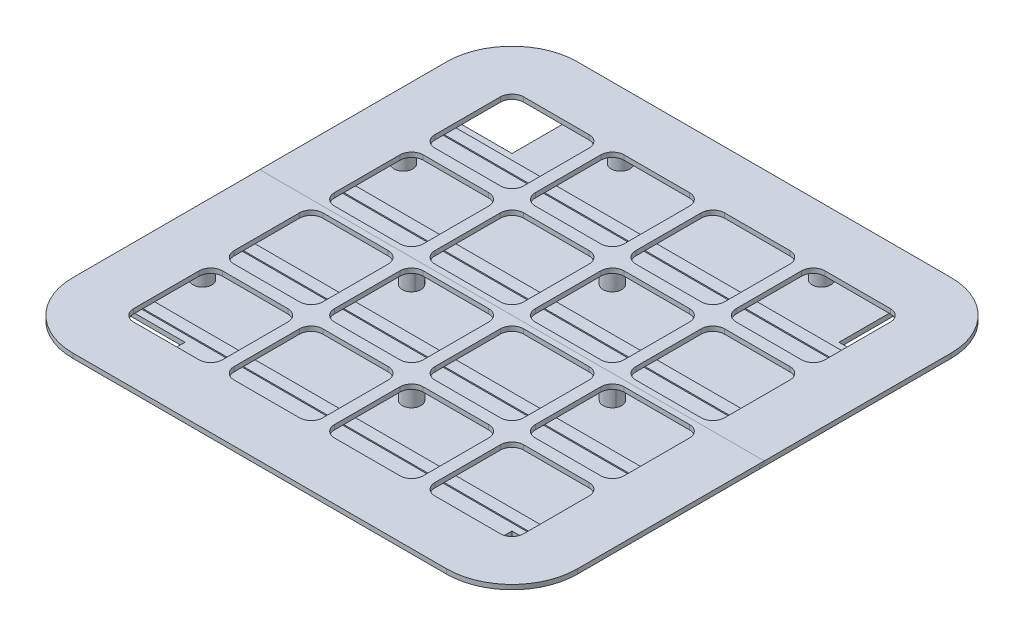
from build123d import *

# Parameters (mm, degrees)
BOSS_EXTRUDE1_DEPTH    = 2
BOSS_EXTRUDE3_START    = 8
BOSS_EXTRUDE3_DEPTH    = 2
SKETCH7_R              = 4
SKETCH7_R_2            = 2.5
BOSS_EXTRUDE7_DEPTH    = 8
SKETCH6_W              = 196
SKETCH6_H              = 5
BOSS_EXTRUDE6_DEPTH    = 0.5
SKETCH7_6_R            = 2.5
CUT_EXTRUDE1_DEPTH     = 10
SPLIT1_SURFACE_1_BACK  = 306.706
SPLIT1_SURFACE_1_DEPTH = 613.412
SPLIT1_SURFACE_2_BACK  = 306.706
SPLIT1_SURFACE_2_DEPTH = 613.412


with BuildPart() as part:
    # Sketch1 → Boss-Extrude1 (new body)
    with BuildSketch(Plane(origin=(0, 0, 0), x_dir=(1, 0, 0), z_dir=(0, 1, 0))):
        Polygon((-70, 98), (-70, 70), (-98, 70), (-98, -70), (-70, -70), (-70, -98), (70, -98), (70, -70), (98, -70), (98, 70), (70, 70), (70, 98), align=None)
    extrude(amount=BOSS_EXTRUDE1_DEPTH)

    # Sketch6 → Boss-Extrude6 (add)
    with BuildSketch(Plane(origin=(0, 2, 0), x_dir=(1, 0, 0), z_dir=(0, 1, 0))):
        with Locations((0, 64.5)):
            Rectangle(SKETCH6_W, SKETCH6_H)
        with Locations((0, 21.5)):
            Rectangle(SKETCH6_W, SKETCH6_H)
        with Locations((0, -21.5)):
            Rectangle(SKETCH6_W, SKETCH6_H)
        with Locations((0, -64.5)):
            Rectangle(SKETCH6_W, SKETCH6_H)
    extrude(amount=BOSS_EXTRUDE6_DEPTH)

    # Sketch7<6> → Cut-Extrude1 (cut)
    with BuildSketch(Plane.XZ.offset(-10)):
        with Locations((-43, 0)):
            Circle(SKETCH7_6_R)
        with Locations((-89.5, 43)):
            Circle(SKETCH7_6_R)
        with Locations((-43, 89.5)):
            Circle(SKETCH7_6_R)
        with Locations((43, 89.5)):
            Circle(SKETCH7_6_R)
        with Locations((89.5, 43)):
            Circle(SKETCH7_6_R)
        with Locations((89.5, -43)):
            Circle(SKETCH7_6_R)
        with Locations((43, -89.5)):
            Circle(SKETCH7_6_R)
        with Locations((-43, -89.5)):
            Circle(SKETCH7_6_R)
        with Locations((-89.5, -43)):
            Circle(SKETCH7_6_R)
        with Locations((43, 0)):
            Circle(SKETCH7_6_R)
        with Locations((0, -43)):
            Circle(SKETCH7_6_R)
        with Locations((0, 43)):
            Circle(SKETCH7_6_R)
    extrude(amount=CUT_EXTRUDE1_DEPTH, mode=Mode.SUBTRACT)


with BuildPart() as body_2:
    # Sketch3 → Boss-Extrude3 (new body)
    with BuildSketch(Plane(origin=(0, 2, 0), x_dir=(1, 0, 0), z_dir=(0, 1, 0)).offset(BOSS_EXTRUDE3_START)):
        with BuildLine():
            Line((80, 108), (-80, 108))
            ThreePointArc((-80, 108), (-99.798989873, 99.798989873), (-108, 80))
            Line((-108, 80), (-108, 70))
            Line((-108, 70), (-108, -80))
            ThreePointArc((-108, -80), (-99.798989873, -99.798989873), (-80, -108))
            Line((-80, -108), (80, -108))
            ThreePointArc((80, -108), (99.798989873, -99.798989873), (108, -80))
            Line((108, -80), (108, 70))
            Line((108, 70), (108, 80))
            ThreePointArc((108, 80), (99.798989873, 99.798989873), (80, 108))
        make_face()
        with BuildLine():
            Line((-35.5, 83.5), (-7.5, 83.5))
            ThreePointArc((-7.5, 83.5), (-3.964466094, 82.035533906), (-2.5, 78.5))
            Line((-2.5, 78.5), (-2.5, 50.5))
            ThreePointArc((-2.5, 50.5), (-3.964466094, 46.964466094), (-7.5, 45.5))
            Line((-7.5, 45.5), (-35.5, 45.5))
            ThreePointArc((-35.5, 45.5), (-39.035533906, 46.964466094), (-40.5, 50.5))
            Line((-40.5, 50.5), (-40.5, 78.5))
            ThreePointArc((-40.5, 78.5), (-39.035533906, 82.035533906), (-35.5, 83.5))
        make_face(mode=Mode.SUBTRACT)
        with BuildLine():
            Line((7.5, 83.5), (35.5, 83.5))
            ThreePointArc((35.5, 83.5), (39.035533906, 82.035533906), (40.5, 78.5))
            Line((40.5, 78.5), (40.5, 50.5))
            ThreePointArc((40.5, 50.5), (39.035533906, 46.964466094), (35.5, 45.5))
            Line((35.5, 45.5), (7.5, 45.5))
            ThreePointArc((7.5, 45.5), (3.964466094, 46.964466094), (2.5, 50.5))
            Line((2.5, 50.5), (2.5, 78.5))
            ThreePointArc((2.5, 78.5), (3.964466094, 82.035533906), (7.5, 83.5))
        make_face(mode=Mode.SUBTRACT)
        with BuildLine():
            Line((-78.5, 83.5), (-50.5, 83.5))
            ThreePointArc((-50.5, 83.5), (-46.964466094, 82.035533906), (-45.5, 78.5))
            Line((-45.5, 78.5), (-45.5, 50.5))
            ThreePointArc((-45.5, 50.5), (-46.964466094, 46.964466094), (-50.5, 45.5))
            Line((-50.5, 45.5), (-78.5, 45.5))
            ThreePointArc((-78.5, 45.5), (-82.035533906, 46.964466094), (-83.5, 50.5))
            Line((-83.5, 50.5), (-83.5, 78.5))
            ThreePointArc((-83.5, 78.5), (-82.035533906, 82.035533906), (-78.5, 83.5))
        make_face(mode=Mode.SUBTRACT)
        with BuildLine():
            Line((50.5, 83.5), (78.5, 83.5))
            ThreePointArc((78.5, 83.5), (82.035533906, 82.035533906), (83.5, 78.5))
            Line((83.5, 78.5), (83.5, 50.5))
            ThreePointArc((83.5, 50.5), (82.035533906, 46.964466094), (78.5, 45.5))
            Line((78.5, 45.5), (50.5, 45.5))
            ThreePointArc((50.5, 45.5), (46.964466094, 46.964466094), (45.5, 50.5))
            Line((45.5, 50.5), (45.5, 78.5))
            ThreePointArc((45.5, 78.5), (46.964466094, 82.035533906), (50.5, 83.5))
        make_face(mode=Mode.SUBTRACT)
        with BuildLine():
            Line((-35.5, 40.5), (-7.5, 40.5))
            ThreePointArc((-7.5, 40.5), (-3.964466094, 39.035533906), (-2.5, 35.5))
            Line((-2.5, 35.5), (-2.5, 7.5))
            ThreePointArc((-2.5, 7.5), (-3.964466094, 3.964466094), (-7.5, 2.5))
            Line((-7.5, 2.5), (-35.5, 2.5))
            ThreePointArc((-35.5, 2.5), (-39.035533906, 3.964466094), (-40.5, 7.5))
            Line((-40.5, 7.5), (-40.5, 35.5))
            ThreePointArc((-40.5, 35.5), (-39.035533906, 39.035533906), (-35.5, 40.5))
        make_face(mode=Mode.SUBTRACT)
        with BuildLine():
            Line((7.5, 40.5), (35.5, 40.5))
            ThreePointArc((35.5, 40.5), (39.035533906, 39.035533906), (40.5, 35.5))
            Line((40.5, 35.5), (40.5, 7.5))
            ThreePointArc((40.5, 7.5), (39.035533906, 3.964466094), (35.5, 2.5))
            Line((35.5, 2.5), (7.5, 2.5))
            ThreePointArc((7.5, 2.5), (3.964466094, 3.964466094), (2.5, 7.5))
            Line((2.5, 7.5), (2.5, 35.5))
            ThreePointArc((2.5, 35.5), (3.964466094, 39.035533906), (7.5, 40.5))
        make_face(mode=Mode.SUBTRACT)
        with BuildLine():
            Line((50.5, 40.5), (78.5, 40.5))
            ThreePointArc((78.5, 40.5), (82.035533906, 39.035533906), (83.5, 35.5))
            Line((83.5, 35.5), (83.5, 7.5))
            ThreePointArc((83.5, 7.5), (82.035533906, 3.964466094), (78.5, 2.5))
            Line((78.5, 2.5), (50.5, 2.5))
            ThreePointArc((50.5, 2.5), (46.964466094, 3.964466094), (45.5, 7.5))
            Line((45.5, 7.5), (45.5, 35.5))
            ThreePointArc((45.5, 35.5), (46.964466094, 39.035533906), (50.5, 40.5))
        make_face(mode=Mode.SUBTRACT)
        with BuildLine():
            Line((-35.5, -2.5), (-7.5, -2.5))
            ThreePointArc((-7.5, -2.5), (-3.964466094, -3.964466094), (-2.5, -7.5))
            Line((-2.5, -7.5), (-2.5, -35.5))
            ThreePointArc((-2.5, -35.5), (-3.964466094, -39.035533906), (-7.5, -40.5))
            Line((-7.5, -40.5), (-35.5, -40.5))
            ThreePointArc((-35.5, -40.5), (-39.035533906, -39.035533906), (-40.5, -35.5))
            Line((-40.5, -35.5), (-40.5, -7.5))
            ThreePointArc((-40.5, -7.5), (-39.035533906, -3.964466094), (-35.5, -2.5))
        make_face(mode=Mode.SUBTRACT)
        with BuildLine():
            Line((7.5, -2.5), (35.5, -2.5))
            ThreePointArc((35.5, -2.5), (39.035533906, -3.964466094), (40.5, -7.5))
            Line((40.5, -7.5), (40.5, -35.5))
            ThreePointArc((40.5, -35.5), (39.035533906, -39.035533906), (35.5, -40.5))
            Line((35.5, -40.5), (7.5, -40.5))
            ThreePointArc((7.5, -40.5), (3.964466094, -39.035533906), (2.5, -35.5))
            Line((2.5, -35.5), (2.5, -7.5))
            ThreePointArc((2.5, -7.5), (3.964466094, -3.964466094), (7.5, -2.5))
        make_face(mode=Mode.SUBTRACT)
        with BuildLine():
            Line((50.5, -2.5), (78.5, -2.5))
            ThreePointArc((78.5, -2.5), (82.035533906, -3.964466094), (83.5, -7.5))
            Line((83.5, -7.5), (83.5, -35.5))
            ThreePointArc((83.5, -35.5), (82.035533906, -39.035533906), (78.5, -40.5))
            Line((78.5, -40.5), (50.5, -40.5))
            ThreePointArc((50.5, -40.5), (46.964466094, -39.035533906), (45.5, -35.5))
            Line((45.5, -35.5), (45.5, -7.5))
            ThreePointArc((45.5, -7.5), (46.964466094, -3.964466094), (50.5, -2.5))
        make_face(mode=Mode.SUBTRACT)
        with BuildLine():
            Line((-35.5, -45.5), (-7.5, -45.5))
            ThreePointArc((-7.5, -45.5), (-3.964466094, -46.964466094), (-2.5, -50.5))
            Line((-2.5, -50.5), (-2.5, -78.5))
            ThreePointArc((-2.5, -78.5), (-3.964466094, -82.035533906), (-7.5, -83.5))
            Line((-7.5, -83.5), (-35.5, -83.5))
            ThreePointArc((-35.5, -83.5), (-39.035533906, -82.035533906), (-40.5, -78.5))
            Line((-40.5, -78.5), (-40.5, -50.5))
            ThreePointArc((-40.5, -50.5), (-39.035533906, -46.964466094), (-35.5, -45.5))
        make_face(mode=Mode.SUBTRACT)
        with BuildLine():
            Line((7.5, -45.5), (35.5, -45.5))
            ThreePointArc((35.5, -45.5), (39.035533906, -46.964466094), (40.5, -50.5))
            Line((40.5, -50.5), (40.5, -78.5))
            ThreePointArc((40.5, -78.5), (39.035533906, -82.035533906), (35.5, -83.5))
            Line((35.5, -83.5), (7.5, -83.5))
            ThreePointArc((7.5, -83.5), (3.964466094, -82.035533906), (2.5, -78.5))
            Line((2.5, -78.5), (2.5, -50.5))
            ThreePointArc((2.5, -50.5), (3.964466094, -46.964466094), (7.5, -45.5))
        make_face(mode=Mode.SUBTRACT)
        with BuildLine():
            Line((50.5, -45.5), (78.5, -45.5))
            ThreePointArc((78.5, -45.5), (82.035533906, -46.964466094), (83.5, -50.5))
            Line((83.5, -50.5), (83.5, -78.5))
            ThreePointArc((83.5, -78.5), (82.035533906, -82.035533906), (78.5, -83.5))
            Line((78.5, -83.5), (50.5, -83.5))
            ThreePointArc((50.5, -83.5), (46.964466094, -82.035533906), (45.5, -78.5))
            Line((45.5, -78.5), (45.5, -50.5))
            ThreePointArc((45.5, -50.5), (46.964466094, -46.964466094), (50.5, -45.5))
        make_face(mode=Mode.SUBTRACT)
        with BuildLine():
            Line((-78.5, 40.5), (-50.5, 40.5))
            ThreePointArc((-50.5, 40.5), (-46.964466094, 39.035533906), (-45.5, 35.5))
            Line((-45.5, 35.5), (-45.5, 7.5))
            ThreePointArc((-45.5, 7.5), (-46.964466094, 3.964466094), (-50.5, 2.5))
            Line((-50.5, 2.5), (-78.5, 2.5))
            ThreePointArc((-78.5, 2.5), (-82.035533906, 3.964466094), (-83.5, 7.5))
            Line((-83.5, 7.5), (-83.5, 35.5))
            ThreePointArc((-83.5, 35.5), (-82.035533906, 39.035533906), (-78.5, 40.5))
        make_face(mode=Mode.SUBTRACT)
        with BuildLine():
            Line((-78.5, -2.5), (-50.5, -2.5))
            ThreePointArc((-50.5, -2.5), (-46.964466094, -3.964466094), (-45.5, -7.5))
            Line((-45.5, -7.5), (-45.5, -35.5))
            ThreePointArc((-45.5, -35.5), (-46.964466094, -39.035533906), (-50.5, -40.5))
            Line((-50.5, -40.5), (-78.5, -40.5))
            ThreePointArc((-78.5, -40.5), (-82.035533906, -39.035533906), (-83.5, -35.5))
            Line((-83.5, -35.5), (-83.5, -7.5))
            ThreePointArc((-83.5, -7.5), (-82.035533906, -3.964466094), (-78.5, -2.5))
        make_face(mode=Mode.SUBTRACT)
        with BuildLine():
            Line((-78.5, -45.5), (-50.5, -45.5))
            ThreePointArc((-50.5, -45.5), (-46.964466094, -46.964466094), (-45.5, -50.5))
            Line((-45.5, -50.5), (-45.5, -78.5))
            ThreePointArc((-45.5, -78.5), (-46.964466094, -82.035533906), (-50.5, -83.5))
            Line((-50.5, -83.5), (-78.5, -83.5))
            ThreePointArc((-78.5, -83.5), (-82.035533906, -82.035533906), (-83.5, -78.5))
            Line((-83.5, -78.5), (-83.5, -50.5))
            ThreePointArc((-83.5, -50.5), (-82.035533906, -46.964466094), (-78.5, -45.5))
        make_face(mode=Mode.SUBTRACT)
    extrude(amount=BOSS_EXTRUDE3_DEPTH)

    # Sketch7 → Boss-Extrude7 (add)
    # profile 1 of 12: a face of its own
    with BuildSketch(Plane.XZ.offset(-10)):
        with Locations((-43, 0)):
            Circle(SKETCH7_R)
        with Locations((-43, 0)):
            Circle(SKETCH7_R_2, mode=Mode.SUBTRACT)
    # profile 2 of 12: a face of its own
    with BuildSketch(Plane.XZ.offset(-10)):
        with Locations((-89.5, 43)):
            Circle(SKETCH7_R)
        with Locations((-89.5, 43)):
            Circle(SKETCH7_R_2, mode=Mode.SUBTRACT)
    # profile 3 of 12: a face of its own
    with BuildSketch(Plane.XZ.offset(-10)):
        with Locations((-43, 89.5)):
            Circle(SKETCH7_R)
        with Locations((-43, 89.5)):
            Circle(SKETCH7_R_2, mode=Mode.SUBTRACT)
    # profile 4 of 12: a face of its own
    with BuildSketch(Plane.XZ.offset(-10)):
        with Locations((43, 89.5)):
            Circle(SKETCH7_R)
        with Locations((43, 89.5)):
            Circle(SKETCH7_R_2, mode=Mode.SUBTRACT)
    # profile 5 of 12: a face of its own
    with BuildSketch(Plane.XZ.offset(-10)):
        with Locations((89.5, 43)):
            Circle(SKETCH7_R)
        with Locations((89.5, 43)):
            Circle(SKETCH7_R_2, mode=Mode.SUBTRACT)
    # profile 6 of 12: a face of its own
    with BuildSketch(Plane.XZ.offset(-10)):
        with Locations((89.5, -43)):
            Circle(SKETCH7_R)
        with Locations((89.5, -43)):
            Circle(SKETCH7_R_2, mode=Mode.SUBTRACT)
    # profile 7 of 12: a face of its own
    with BuildSketch(Plane.XZ.offset(-10)):
        with Locations((43, -89.5)):
            Circle(SKETCH7_R)
        with Locations((43, -89.5)):
            Circle(SKETCH7_R_2, mode=Mode.SUBTRACT)
    # profile 8 of 12: a face of its own
    with BuildSketch(Plane.XZ.offset(-10)):
        with Locations((-43, -89.5)):
            Circle(SKETCH7_R)
        with Locations((-43, -89.5)):
            Circle(SKETCH7_R_2, mode=Mode.SUBTRACT)
    # profile 9 of 12: a face of its own
    with BuildSketch(Plane.XZ.offset(-10)):
        with Locations((-89.5, -43)):
            Circle(SKETCH7_R)
        with Locations((-89.5, -43)):
            Circle(SKETCH7_R_2, mode=Mode.SUBTRACT)
    # profile 10 of 12: a face of its own
    with BuildSketch(Plane.XZ.offset(-10)):
        with Locations((43, 0)):
            Circle(SKETCH7_R)
        with Locations((43, 0)):
            Circle(SKETCH7_R_2, mode=Mode.SUBTRACT)
    # profile 11 of 12: a face of its own
    with BuildSketch(Plane.XZ.offset(-10)):
        with Locations((0, -43)):
            Circle(SKETCH7_R)
        with Locations((0, -43)):
            Circle(SKETCH7_R_2, mode=Mode.SUBTRACT)
    # profile 12 of 12: a face of its own
    with BuildSketch(Plane.XZ.offset(-10)):
        with Locations((0, 43)):
            Circle(SKETCH7_R)
        with Locations((0, 43)):
            Circle(SKETCH7_R_2, mode=Mode.SUBTRACT)
    extrude(amount=BOSS_EXTRUDE7_DEPTH)


with BuildPart() as body_3:
    # Split1: the piece behind the surface
    add(body_2.part)
    # Split1 surface: a surface, the sketch's curves swept straight by 613.412 mm
    with BuildLine(Plane(origin=(108, 0, 0), x_dir=(0, 0, -1), z_dir=(1, 0, 0)).offset(-SPLIT1_SURFACE_1_BACK), mode=Mode.PRIVATE) as split1_surface_1_path:
        Line((0, 12), (0, 11))
        Line((0, 11), (-2, 11))
        Line((-2, 11), (-2, 10))
        Line((-2, 10), (-2, 2))
    split1_surface_1 = Shell.extrude(split1_surface_1_path.wire(), (1 * SPLIT1_SURFACE_1_DEPTH, 0 * SPLIT1_SURFACE_1_DEPTH, 0 * SPLIT1_SURFACE_1_DEPTH))
    split(bisect_by=split1_surface_1, keep=Keep.BOTTOM)


with BuildPart() as body_2_1:
    add(body_2.part)

    # Split1: split by a surface, the side it looks to stays
    # Split1 surface: a surface, the sketch's curves swept straight by 613.412 mm
    with BuildLine(Plane(origin=(108, 0, 0), x_dir=(0, 0, -1), z_dir=(1, 0, 0)).offset(-SPLIT1_SURFACE_2_BACK), mode=Mode.PRIVATE) as split1_surface_2_path:
        Line((0, 12), (0, 11))
        Line((0, 11), (-2, 11))
        Line((-2, 11), (-2, 10))
        Line((-2, 10), (-2, 2))
    split1_surface_2 = Shell.extrude(split1_surface_2_path.wire(), (1 * SPLIT1_SURFACE_2_DEPTH, 0 * SPLIT1_SURFACE_2_DEPTH, 0 * SPLIT1_SURFACE_2_DEPTH))
    split(bisect_by=split1_surface_2, keep=Keep.TOP)


solid = Compound([part.part, body_3.part, body_2_1.part])
